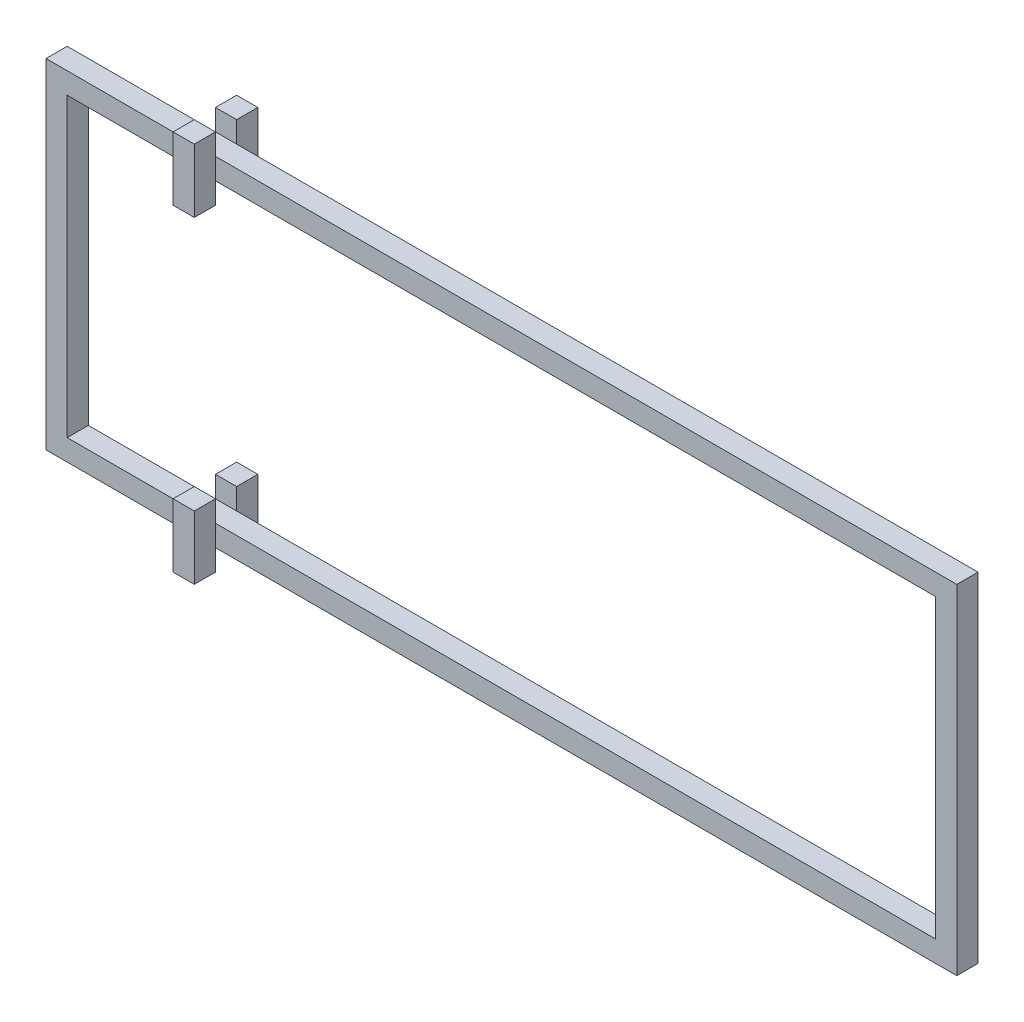
from build123d import *

# Parameters (mm, degrees)
SKETCH1_W           = 109.22
SKETCH1_H           = 40.64
SKETCH1_W_2         = 104.14
SKETCH1_H_2         = 35.56
BOSS_EXTRUDE1_DEPTH = 2.54
SKETCH2_W           = 2.54
SKETCH2_H           = 2.54
BOSS_EXTRUDE2_DEPTH = 2.54
SKETCH4_W           = 2.54
SKETCH4_H           = 2.54
BOSS_EXTRUDE3_DEPTH = 2.54
SKETCH6_W           = 2.54
SKETCH6_H           = 2.54
BOSS_EXTRUDE4_DEPTH = 2.54


with BuildPart() as part:
    # Sketch1 → Boss-Extrude1 (new body)
    with BuildSketch(Plane.XY):
        with Locations((-54.61, 20.32)):
            Rectangle(SKETCH1_W, SKETCH1_H)
        with Locations((-54.61, 20.32)):
            Rectangle(SKETCH1_W_2, SKETCH1_H_2, mode=Mode.SUBTRACT)
    extrude(amount=BOSS_EXTRUDE1_DEPTH)

    # Sketch2 → Boss-Extrude2 (add)
    with BuildSketch(Plane(origin=(0, 0, 0), x_dir=(-1, 0, 0), z_dir=(0, 0, -1))):
        with Locations((90.17, 39.37)):
            Rectangle(SKETCH2_W, SKETCH2_H)
        with Locations((90.17, 1.27)):
            Rectangle(SKETCH2_W, SKETCH2_H)
    boss_extrude2 = extrude(amount=BOSS_EXTRUDE2_DEPTH)

    # Mirror1: Boss-Extrude2 across plane
    add(boss_extrude2.mirror(Plane.XY.offset(1.27)))

    # Sketch4 → Boss-Extrude3 (add)
    with BuildSketch(Plane(origin=(0, 40.64, 0), x_dir=(1, 0, 0), z_dir=(0, 1, 0))):
        with Locations((-90.17, 1.27)):
            Rectangle(SKETCH4_W, SKETCH4_H)
        with Locations((-90.17, -3.81)):
            Rectangle(SKETCH4_W, SKETCH4_H)
    boss_extrude3 = extrude(amount=BOSS_EXTRUDE3_DEPTH)

    # Sketch6 → Boss-Extrude4 (add)
    with BuildSketch(Plane(origin=(0, 38.1, 0), x_dir=(-1, 0, 0), z_dir=(0, -1, 0))):
        with Locations((90.17, 1.27)):
            Rectangle(SKETCH6_W, SKETCH6_H)
        with Locations((90.17, -3.81)):
            Rectangle(SKETCH6_W, SKETCH6_H)
    boss_extrude4 = extrude(amount=BOSS_EXTRUDE4_DEPTH)

    # Mirror3: Boss-Extrude3, Boss-Extrude4 across plane
    add(boss_extrude3.mirror(Plane(origin=(0, 20.32, 0), x_dir=(0, 0, 1), z_dir=(0, -1, 0))))
    add(boss_extrude4.mirror(Plane(origin=(0, 20.32, 0), x_dir=(0, 0, 1), z_dir=(0, -1, 0))))


solid = part.part
